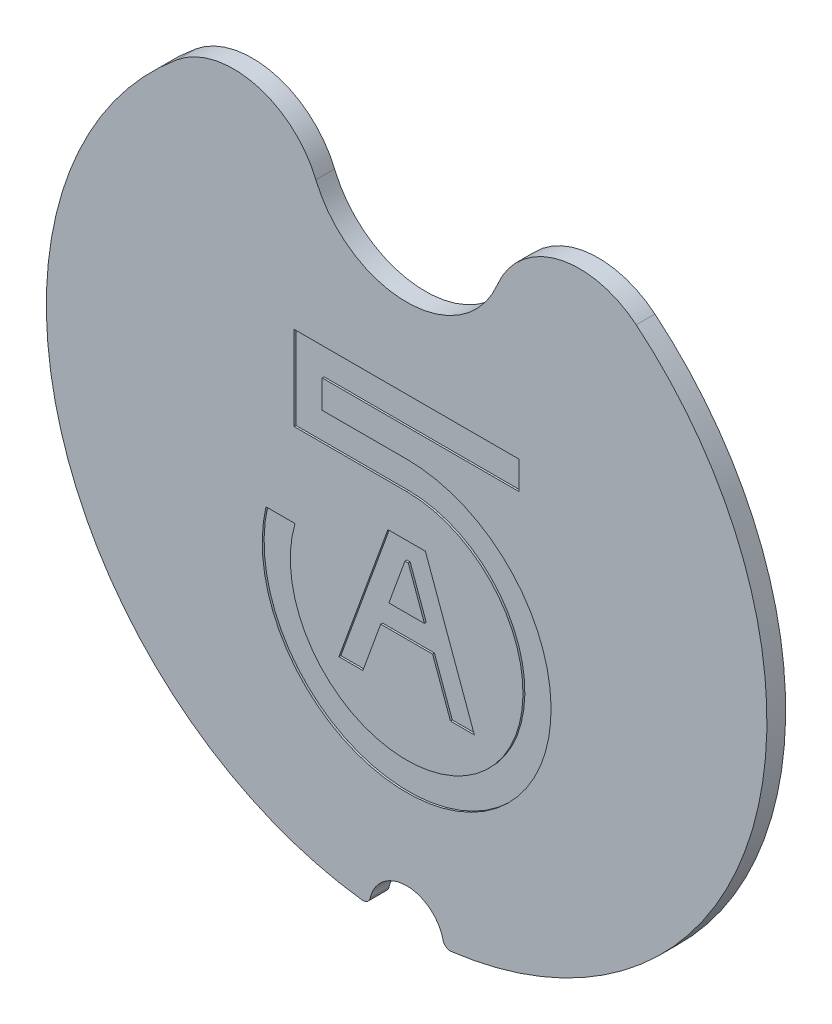
from build123d import *

# Parameters (mm, degrees)
SALIENTE_EXTRUIR1_DEPTH = 5
CORTAR_EXTRUIR1_DEPTH   = 0.5
REDONDEO1_R             = 2
REDONDEO2_R             = 2


with BuildPart() as part:
    # Croquis2 → Saliente-Extruir1 (new body)
    with BuildSketch(Plane.XY):
        with BuildLine():
            ThreePointArc((-61.331528305, 74.17887931), (-92.135043085, -27.842347885), (-9.986497884, -95.730519481))
            ThreePointArc((-9.986497884, -95.730519481), (0, -86.25), (9.986497884, -95.730519481))
            ThreePointArc((9.986497884, -95.730519481), (92.135043085, -27.842347885), (61.331528305, 74.17887931))
            ThreePointArc((61.331528305, 74.17887931), (40.466763827, 78.9231673), (24.253831648, 64.959375))
            ThreePointArc((24.253831648, 64.959375), (0, 48.75), (-24.253831648, 64.959375))
            ThreePointArc((-24.253831648, 64.959375), (-40.466763827, 78.9231673), (-61.331528305, 74.17887931))
        make_face()
    extrude(amount=SALIENTE_EXTRUIR1_DEPTH)

    # Croquis3 → Cortar-Extruir1 (cut)
    # profile 1 of 2: a face of its own
    with BuildSketch(Plane.XY.offset(5)):
        with BuildLine():
            Line((30.060560178, 27.454508154), (-30.060560178, 27.454508154))
            Line((-30.060560178, 27.454508154), (-30.060560178, 4.954508154))
            Line((-30.060560178, 4.954508154), (0, 4.954508154))
            ThreePointArc((0, 4.954508154), (18.623585271, -51.006906249), (-29.81944868, -17.364815175))
            Line((-29.81944868, -17.364815175), (-37.571846699, -17.364815175))
            ThreePointArc((-37.571846699, -17.364815175), (23.983513651, -56.343925991), (0, 12.454508154))
            Line((0, 12.454508154), (-22.560560178, 12.454508154))
            Line((-22.560560178, 12.454508154), (-22.560560178, 19.954508154))
            Line((-22.560560178, 19.954508154), (30.060560178, 19.954508154))
            Line((30.060560178, 19.954508154), (30.060560178, 27.454508154))
        make_face()
    # profile 2 of 2: a face of its own
    with BuildSketch(Plane.XY.offset(5)):
        Polygon((-5, -6.355312768), (5, -6.355312768), (18.083784961, -42.302716508), (11.698718326, -42.302716508), (6.928526472, -29.196722105), (-6.928526472, -29.196722105), (-11.698718326, -42.302716508), (-18.083784961, -42.302716508), align=None)
        Polygon((-4.744705067, -23.196722105), (4.744705067, -23.196722105), (0.434784536, -11.355312768), (-0.434784536, -11.355312768), align=None, mode=Mode.SUBTRACT)
    extrude(amount=-CORTAR_EXTRUIR1_DEPTH, mode=Mode.SUBTRACT)

    # Redondeo1
    redondeo1_edges = [part.edges().sort_by_distance(p)[0] for p in [
        (-9.986497884, -95.730519481, 2.5),
    ]]
    fillet(redondeo1_edges, radius=REDONDEO1_R)

    # Redondeo2
    redondeo2_edges = [part.edges().sort_by_distance(p)[0] for p in [
        (9.986497884, -95.730519481, 2.5),
    ]]
    fillet(redondeo2_edges, radius=REDONDEO2_R)


solid = part.part
